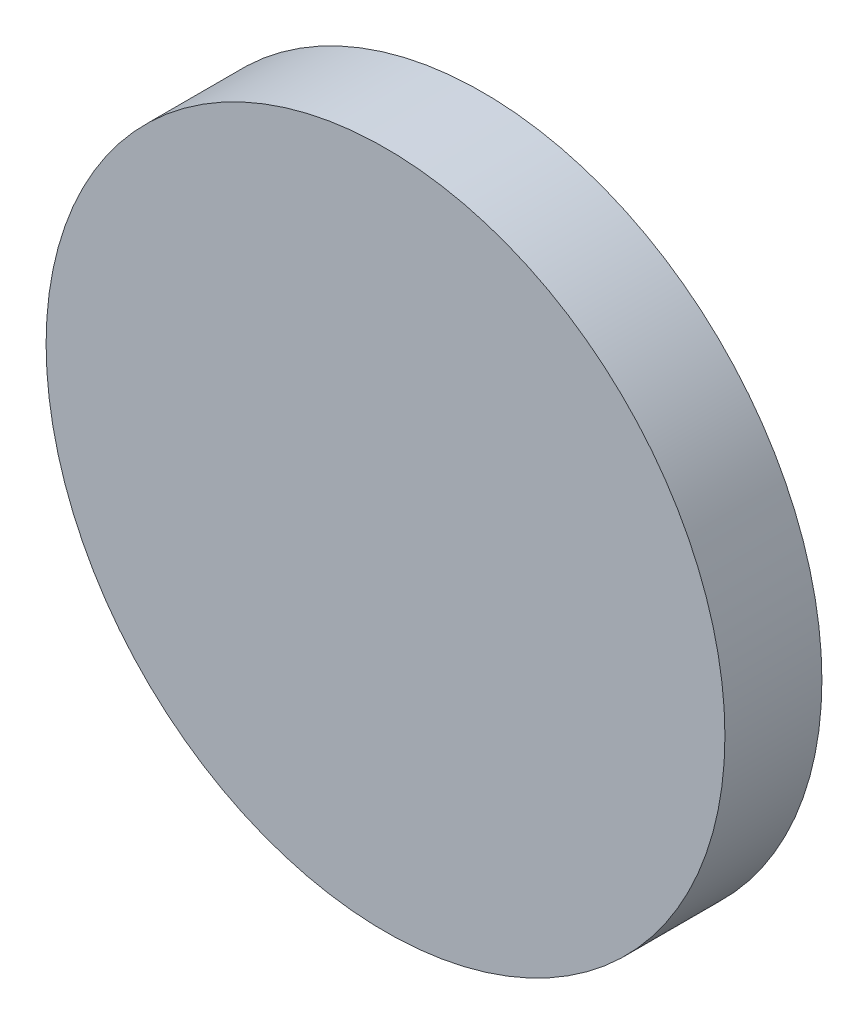
from build123d import *

# Parameters (mm, degrees)
SKETCH1_R           = 22.225
BOSS_EXTRUDE1_DEPTH = 6.35


with BuildPart() as part:
    # Sketch1 → Boss-Extrude1 (new body)
    with BuildSketch(Plane.XY):
        Circle(SKETCH1_R)
    extrude(amount=BOSS_EXTRUDE1_DEPTH)


solid = part.part
